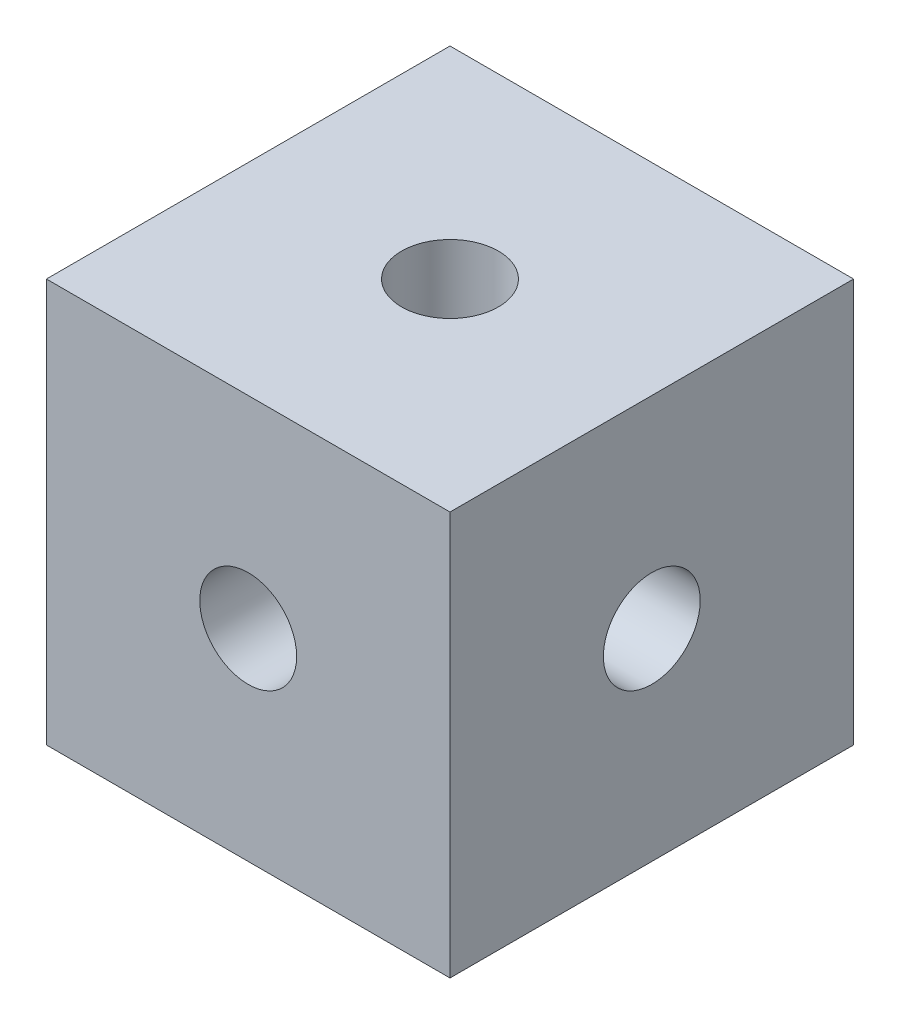
from build123d import *

# Parameters (mm, degrees)
SKETCH_1_W          = 10
SKETCH_1_H          = 10
SKETCH_1_R          = 1.2
EXTRUDE_1_DEPTH     = 10
SKETCH_2_R          = 1.2
CUT_EXTRUDE_1_DEPTH = 18.320508076
SKETCH_3_R          = 1.2
CUT_EXTRUDE_2_DEPTH = 10


with BuildPart() as part:
    # 草图1 → 凸台-拉伸1 (new body)
    with BuildSketch(Plane.XY):
        with Locations((5, 5)):
            Rectangle(SKETCH_1_W, SKETCH_1_H)
        with Locations((5, 5)):
            Circle(SKETCH_1_R, mode=Mode.SUBTRACT)
    extrude(amount=EXTRUDE_1_DEPTH)

    # 草图2 → 切除-拉伸1 (cut, through all)
    with BuildSketch(Plane(origin=(0, 10, 0), x_dir=(1, 0, 0), z_dir=(0, 1, 0))):
        with Locations(Location((5, -5, 0), (0, 0, 180))):
            Circle(SKETCH_2_R)
    extrude(amount=-CUT_EXTRUDE_1_DEPTH, mode=Mode.SUBTRACT)

    # 草图3 → 切除-拉伸2 (cut)
    with BuildSketch(Plane(origin=(10, 0, 0), x_dir=(0, 0, -1), z_dir=(1, 0, 0))):
        with Locations((-5, 5)):
            Circle(SKETCH_3_R)
    extrude(amount=-CUT_EXTRUDE_2_DEPTH, mode=Mode.SUBTRACT)


solid = part.part
